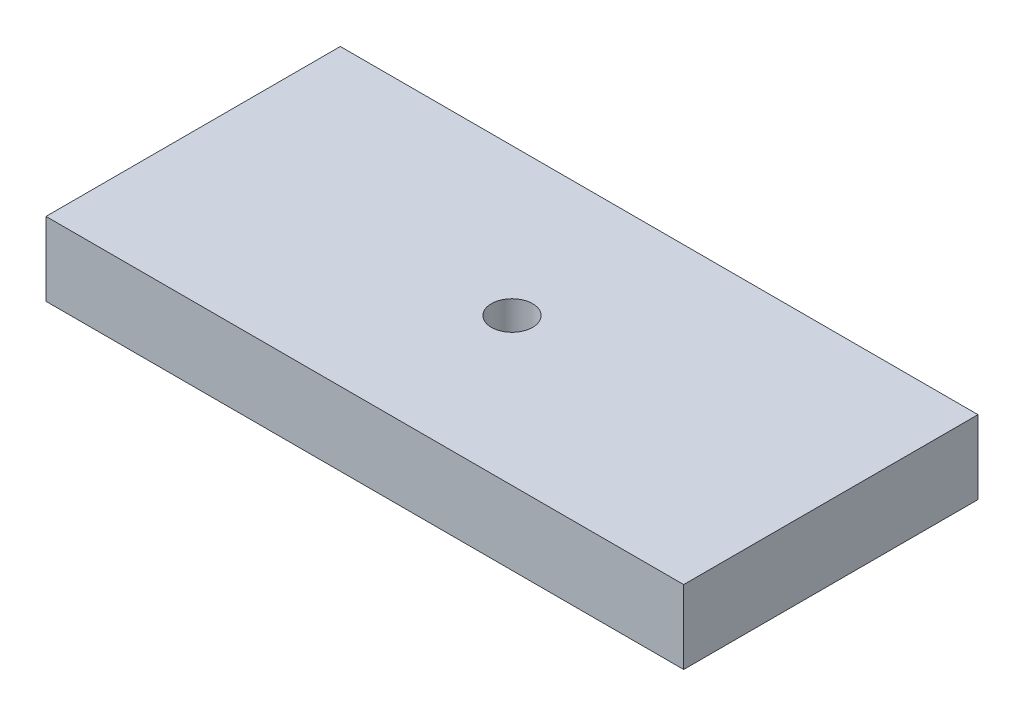
from build123d import *

# Parameters (mm, degrees)
SKETCH1_W           = 130
SKETCH1_H           = 60
BOSS_EXTRUDE1_DEPTH = 15
SKETCH2_R           = 4.195557584
CUT_EXTRUDE1_DEPTH  = 74.143694192


with BuildPart() as part:
    # Sketch1 → Boss-Extrude1 (new body)
    with BuildSketch(Plane(origin=(0, 0, 0), x_dir=(1, 0, 0), z_dir=(0, 1, 0))):
        Rectangle(SKETCH1_W, SKETCH1_H)
    extrude(amount=BOSS_EXTRUDE1_DEPTH)

    # Sketch2 → Cut-Extrude1 (cut, through all)
    with BuildSketch(Plane(origin=(0, 15, 0), x_dir=(1, 0, 0), z_dir=(0, 1, 0))):
        with Locations(Location((0, 0, 0), (0, 0, 270))):
            Circle(SKETCH2_R)
    extrude(amount=-CUT_EXTRUDE1_DEPTH, mode=Mode.SUBTRACT)


solid = part.part
